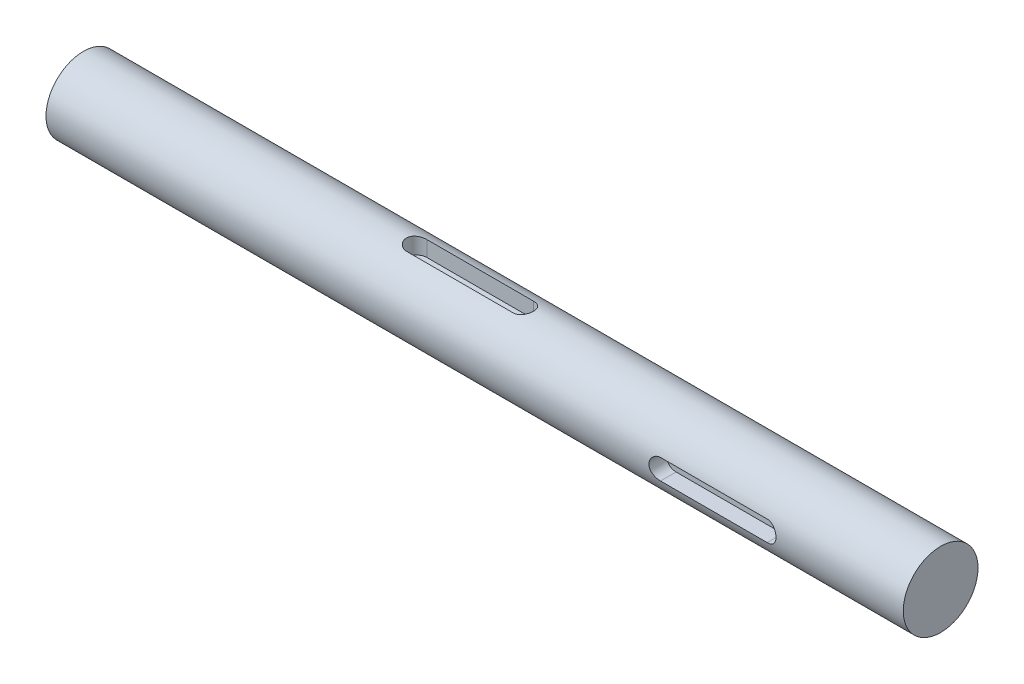
from build123d import *

# Parameters (mm, degrees)
SKETCH1_W           = 140
SKETCH1_H           = 11
CUT_EXTRUDE1_DEPTH  = 5
SKETCH5_R           = 11
BOSS_EXTRUDE1_DEPTH = 97.36
CUT_EXTRUDE2_DEPTH  = 5
SKETCH8_R           = 11
BOSS_EXTRUDE2_DEPTH = 15


with BuildPart() as part:
    # Sketch1 → Revolve1 (revolve)
    with BuildSketch(Plane.XY, mode=Mode.PRIVATE) as revolve1_sk:
        with Locations((70, 5.5)):
            Rectangle(SKETCH1_W, SKETCH1_H)
    revolve(revolve1_sk.sketch.rotate(Axis((0, 0, 0), (1, 0, 0)), 90), axis=Axis((0, 0, 0), (1, 0, 0)))

    # Sketch4 → Cut-Extrude1 (cut)
    with BuildSketch(Plane(origin=(0, 11, 0), x_dir=(1, 0, 0), z_dir=(0, 1, 0))):
        with BuildLine():
            Line((129.52, -3), (98.12, -3))
            ThreePointArc((98.12, -3), (95.12, 0), (98.12, 3))
            Line((98.12, 3), (129.52, 3))
            ThreePointArc((129.52, 3), (132.52, 0), (129.52, -3))
        make_face()
    cut_extrude1 = extrude(amount=-CUT_EXTRUDE1_DEPTH, mode=Mode.SUBTRACT)

    # Mirror1: Cut-Extrude1 across plane
    add(cut_extrude1.mirror(Plane.ZX), mode=Mode.SUBTRACT)

    # Sketch5 → Boss-Extrude1 (add)
    with BuildSketch(Plane(origin=(140, 0, 0), x_dir=(0, 0, -1), z_dir=(1, 0, 0))):
        with Locations(Location((0, 0, 0), (0, 0, 180))):
            Circle(SKETCH5_R)
    extrude(amount=BOSS_EXTRUDE1_DEPTH)

    # Sketch7 → Cut-Extrude2 (cut)
    with BuildSketch(Plane.XY.offset(11)):
        with BuildLine():
            Line((211.88, -3), (180.48, -3))
            ThreePointArc((180.48, -3), (177.48, 0), (180.48, 3))
            Line((180.48, 3), (211.88, 3))
            ThreePointArc((211.88, 3), (214.88, 0), (211.88, -3))
        make_face()
    cut_extrude2 = extrude(amount=-CUT_EXTRUDE2_DEPTH, mode=Mode.SUBTRACT)

    # Mirror2: Cut-Extrude2 across plane
    add(cut_extrude2.mirror(Plane.XY), mode=Mode.SUBTRACT)

    # Sketch8 → Boss-Extrude2 (add)
    with BuildSketch(Plane(origin=(237.36, 0, 0), x_dir=(0, 0, -1), z_dir=(1, 0, 0))):
        with Locations(Location((0, 0, 0), (0, 0, 180))):
            Circle(SKETCH8_R)
    extrude(amount=BOSS_EXTRUDE2_DEPTH)


solid = part.part
